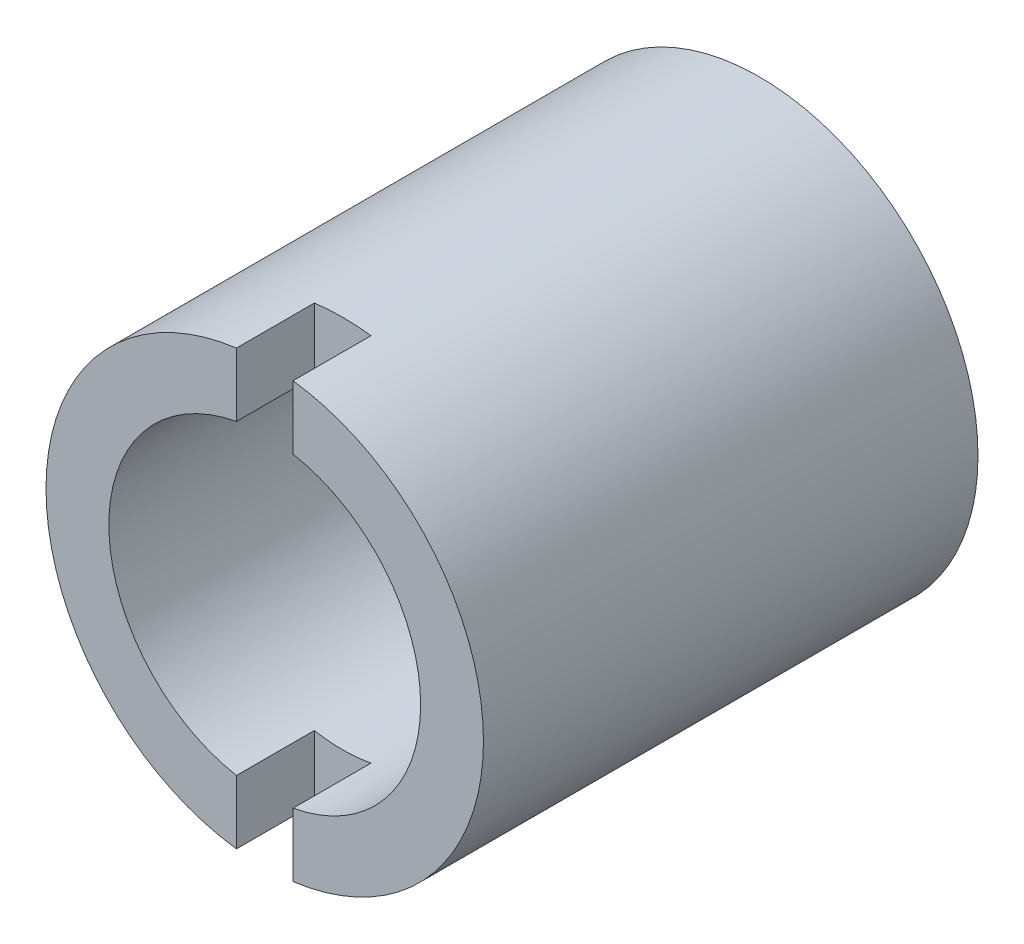
from build123d import *

# Parameters (mm, degrees)
CROQUIS1_R            = 9.12
CROQUIS1_R_2          = 6.5
EXTRUIR_L_MINA1_DEPTH = 20.62
CROQUIS2_W            = 2.36
CROQUIS2_H            = 20
CORTAR_EXTRUIR1_DEPTH = 3.25


with BuildPart() as part:
    # Croquis1 → Extruir-Lámina1 (new body)
    with BuildSketch(Plane.XY):
        Circle(CROQUIS1_R)
        Circle(CROQUIS1_R_2, mode=Mode.SUBTRACT)
    extrude(amount=-EXTRUIR_L_MINA1_DEPTH)

    # Croquis2 → Cortar-Extruir1 (cut)
    with BuildSketch(Plane.XY):
        Rectangle(CROQUIS2_W, CROQUIS2_H)
    extrude(amount=-CORTAR_EXTRUIR1_DEPTH, mode=Mode.SUBTRACT)


solid = part.part
